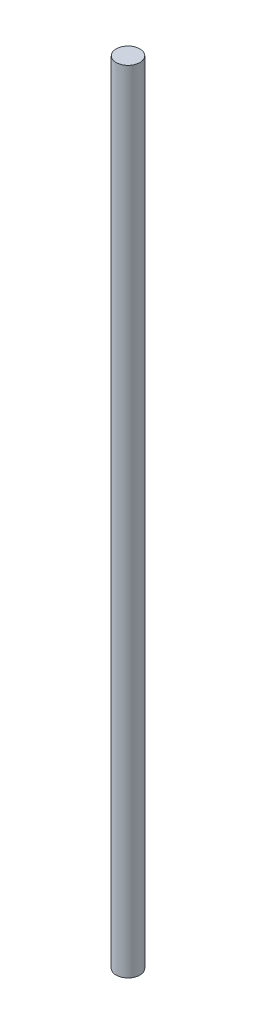
from build123d import *

# Parameters (mm, degrees)
BASE_OUTLINE_SKETCH_R = 1.5
BASE_OUTLINE_DEPTH    = 100


with BuildPart() as part:
    # Base Outline Sketch → Base Outline (new body)
    with BuildSketch(Plane(origin=(0, 65.1, 0), x_dir=(1, 0, 0), z_dir=(0, 1, 0))):
        with Locations(Location((-56.291651246, -50, 0), (0, 0, 270))):
            Circle(BASE_OUTLINE_SKETCH_R)
    extrude(amount=BASE_OUTLINE_DEPTH)


solid = part.part
